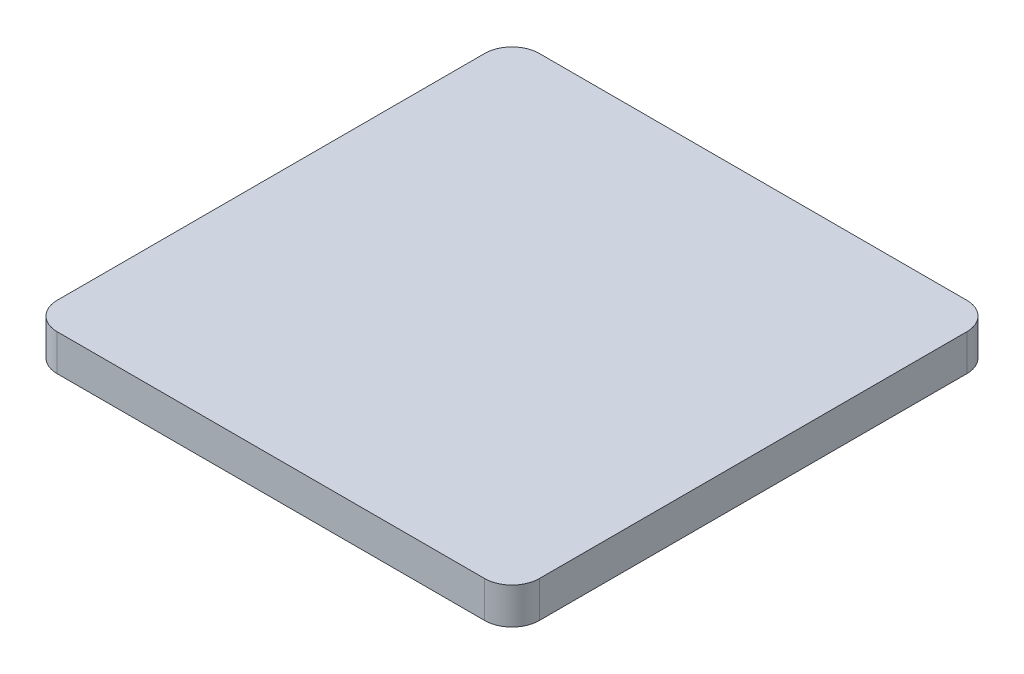
from build123d import *

# Parameters (mm, degrees)
SKETCH1_W           = 53
SKETCH1_H           = 53
BOSS_EXTRUDE1_DEPTH = 4
FILLET2_R           = 3


with BuildPart() as part:
    # Sketch1 → Boss-Extrude1 (new body)
    with BuildSketch(Plane(origin=(0, 0, 0), x_dir=(1, 0, 0), z_dir=(0, 1, 0))):
        with Locations((26.5, 26.5)):
            Rectangle(SKETCH1_W, SKETCH1_H)
    extrude(amount=BOSS_EXTRUDE1_DEPTH)

    # Fillet2
    fillet2_edges = [part.edges().sort_by_distance(p)[0] for p in [
        (0, 2, -53),
        (53, 2, -53),
        (53, 2, 0),
        (0, 2, 0),
    ]]
    fillet(fillet2_edges, radius=FILLET2_R)


solid = part.part
